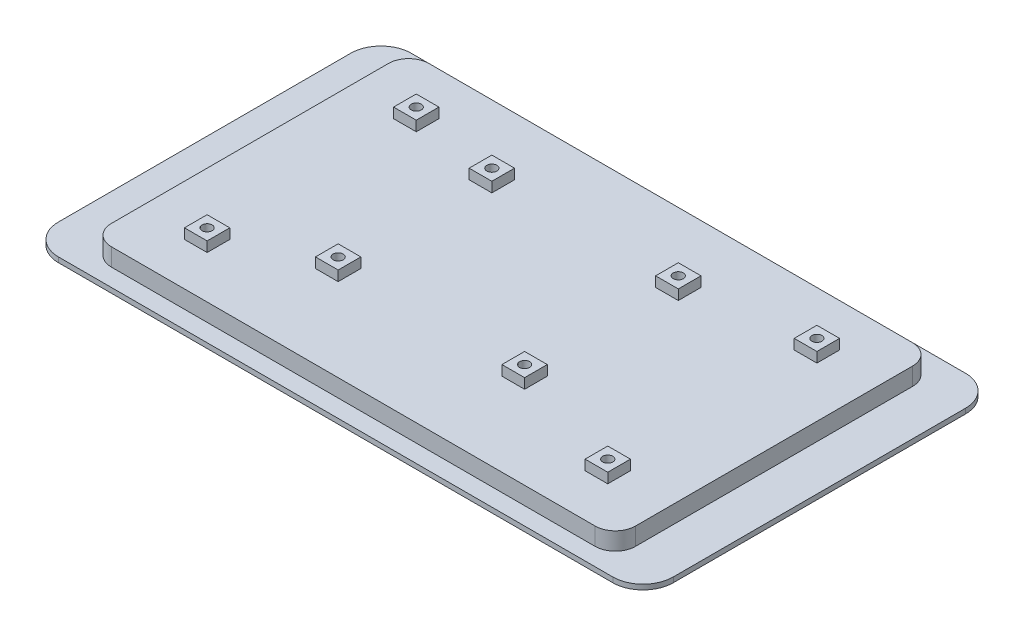
from build123d import *

# Parameters (mm, degrees)
BOSS_EXTRUDE1_DEPTH = 1.5875
BOSS_EXTRUDE2_DEPTH = 5.55625
SKETCH3_W           = 7.14375
SKETCH3_H           = 7.14375
SKETCH3_R           = 1.5875
BOSS_EXTRUDE3_DEPTH = 3.175
SKETCH4_W           = 7.14502
SKETCH4_H           = 7.14502
SKETCH4_R           = 1.5875
BOSS_EXTRUDE4_DEPTH = 3.175


with BuildPart() as part:
    # Sketch1 → Boss-Extrude1 (new body)
    with BuildSketch(Plane(origin=(0, 0, 0), x_dir=(1, 0, 0), z_dir=(0, 1, 0))):
        with BuildLine():
            Line((87.3125, 55.5625), (-87.3125, 55.5625))
            ThreePointArc((-87.3125, 55.5625), (-94.047692091, 52.772692091), (-96.8375, 46.0375))
            Line((-96.8375, 46.0375), (-96.8375, -46.0375))
            ThreePointArc((-96.8375, -46.0375), (-94.047692091, -52.772692091), (-87.3125, -55.5625))
            Line((-87.3125, -55.5625), (87.3125, -55.5625))
            ThreePointArc((87.3125, -55.5625), (94.047692091, -52.772692091), (96.8375, -46.0375))
            Line((96.8375, -46.0375), (96.8375, 46.0375))
            ThreePointArc((96.8375, 46.0375), (94.047692091, 52.772692091), (87.3125, 55.5625))
        make_face()
    extrude(amount=BOSS_EXTRUDE1_DEPTH)

    # Sketch2 → Boss-Extrude2 (add)
    with BuildSketch(Plane(origin=(0, 1.5875, 0), x_dir=(1, 0, 0), z_dir=(0, 1, 0))):
        with BuildLine():
            Line((76.2, 50.00625), (-76.2, 50.00625))
            ThreePointArc((-76.2, 50.00625), (-80.690128061, 48.146378061), (-82.55, 43.65625))
            Line((-82.55, 43.65625), (-82.55, -43.65625))
            ThreePointArc((-82.55, -43.65625), (-80.690128061, -48.146378061), (-76.2, -50.00625))
            Line((-76.2, -50.00625), (76.2, -50.00625))
            ThreePointArc((76.2, -50.00625), (80.690128061, -48.146378061), (82.55, -43.65625))
            Line((82.55, -43.65625), (82.55, 43.65625))
            ThreePointArc((82.55, 43.65625), (80.690128061, 48.146378061), (76.2, 50.00625))
        make_face()
    extrude(amount=BOSS_EXTRUDE2_DEPTH)

    # Sketch3 → Boss-Extrude3 (add)
    # profile 1 of 4: a face of its own
    with BuildSketch(Plane(origin=(0, 7.14375, 0), x_dir=(1, 0, 0), z_dir=(0, 1, 0))):
        with Locations((-63.103125, -32.940625)):
            Rectangle(SKETCH3_W, SKETCH3_H)
        with Locations(Location((-63.103125, -32.940625, 0), (0, 0, 270))):
            Circle(SKETCH3_R, mode=Mode.SUBTRACT)
    # profile 2 of 4: a face of its own
    with BuildSketch(Plane(origin=(0, 7.14375, 0), x_dir=(1, 0, 0), z_dir=(0, 1, 0))):
        with Locations((63.103125, -32.940625)):
            Rectangle(SKETCH3_W, SKETCH3_H)
        with Locations(Location((63.103125, -32.940625, 0), (0, 0, 90))):
            Circle(SKETCH3_R, mode=Mode.SUBTRACT)
    # profile 3 of 4: a face of its own
    with BuildSketch(Plane(origin=(0, 7.14375, 0), x_dir=(1, 0, 0), z_dir=(0, 1, 0))):
        with Locations((63.103125, 32.940625)):
            Rectangle(SKETCH3_W, SKETCH3_H)
        with Locations(Location((63.103125, 32.940625, 0), (0, 0, 270))):
            Circle(SKETCH3_R, mode=Mode.SUBTRACT)
    # profile 4 of 4: a face of its own
    with BuildSketch(Plane(origin=(0, 7.14375, 0), x_dir=(1, 0, 0), z_dir=(0, 1, 0))):
        with Locations((-63.103125, 32.940625)):
            Rectangle(SKETCH3_W, SKETCH3_H)
        with Locations(Location((-63.103125, 32.940625, 0), (0, 0, 90))):
            Circle(SKETCH3_R, mode=Mode.SUBTRACT)
    extrude(amount=BOSS_EXTRUDE3_DEPTH)

    # Sketch4 → Boss-Extrude4 (add)
    # profile 1 of 4: a face of its own
    with BuildSketch(Plane(origin=(0, 7.14375, 0), x_dir=(1, 0, 0), z_dir=(0, 1, 0))):
        with Locations((24.20874, -20.23999)):
            Rectangle(SKETCH4_W, SKETCH4_H)
        with Locations(Location((24.20874, -20.23999, 0), (0, 0, 270))):
            Circle(SKETCH4_R, mode=Mode.SUBTRACT)
    # profile 2 of 4: a face of its own
    with BuildSketch(Plane(origin=(0, 7.14375, 0), x_dir=(1, 0, 0), z_dir=(0, 1, 0))):
        with Locations((-34.52749, -20.23999)):
            Rectangle(SKETCH4_W, SKETCH4_H)
        with Locations(Location((-34.52749, -20.23999, 0), (0, 0, 90))):
            Circle(SKETCH4_R, mode=Mode.SUBTRACT)
    # profile 3 of 4: a face of its own
    with BuildSketch(Plane(origin=(0, 7.14375, 0), x_dir=(1, 0, 0), z_dir=(0, 1, 0))):
        with Locations((-34.52749, 28.17749)):
            Rectangle(SKETCH4_W, SKETCH4_H)
        with Locations(Location((-34.52749, 28.17749, 0), (0, 0, 270))):
            Circle(SKETCH4_R, mode=Mode.SUBTRACT)
    # profile 4 of 4: a face of its own
    with BuildSketch(Plane(origin=(0, 7.14375, 0), x_dir=(1, 0, 0), z_dir=(0, 1, 0))):
        with Locations((24.20874, 28.17749)):
            Rectangle(SKETCH4_W, SKETCH4_H)
        with Locations(Location((24.20874, 28.17749, 0), (0, 0, 90))):
            Circle(SKETCH4_R, mode=Mode.SUBTRACT)
    extrude(amount=BOSS_EXTRUDE4_DEPTH)


solid = part.part
